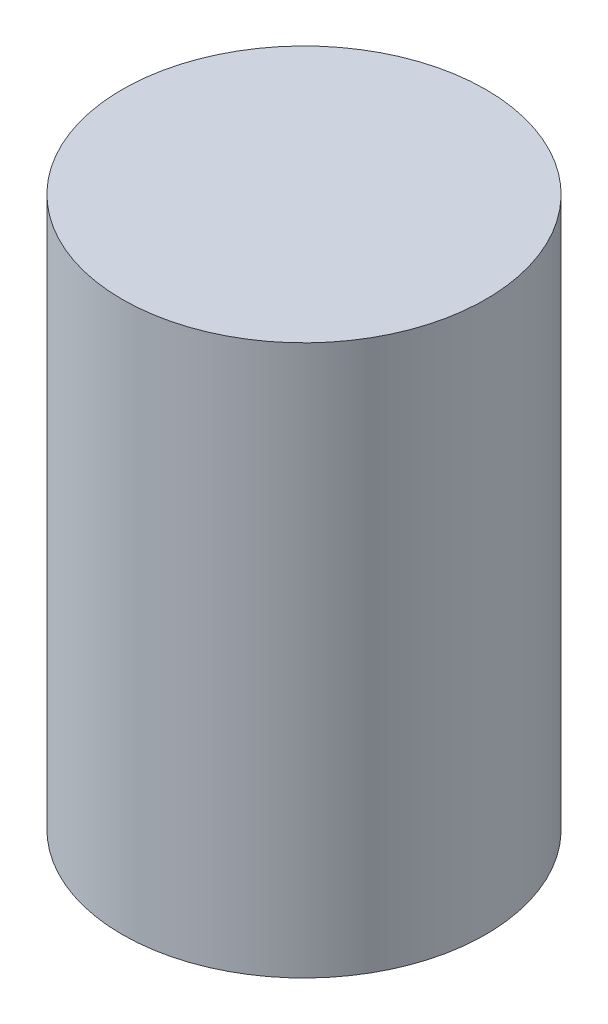
from build123d import *

# Parameters (mm, degrees)
SKETCH2_W = 22.692883694
SKETCH2_H = 7.5


with BuildPart() as part:
    # Sketch2 → Revolve2 (revolve)
    with BuildSketch(Plane.YZ, mode=Mode.PRIVATE) as revolve2_sk:
        with Locations((3.846441847, 3.75)):
            Rectangle(SKETCH2_W, SKETCH2_H)
    revolve(revolve2_sk.sketch.rotate(Axis((0, -13.007574153, 0), (0, 1, 0)), 180), axis=Axis((0, -13.007574153, 0), (0, 1, 0)))


solid = part.part
